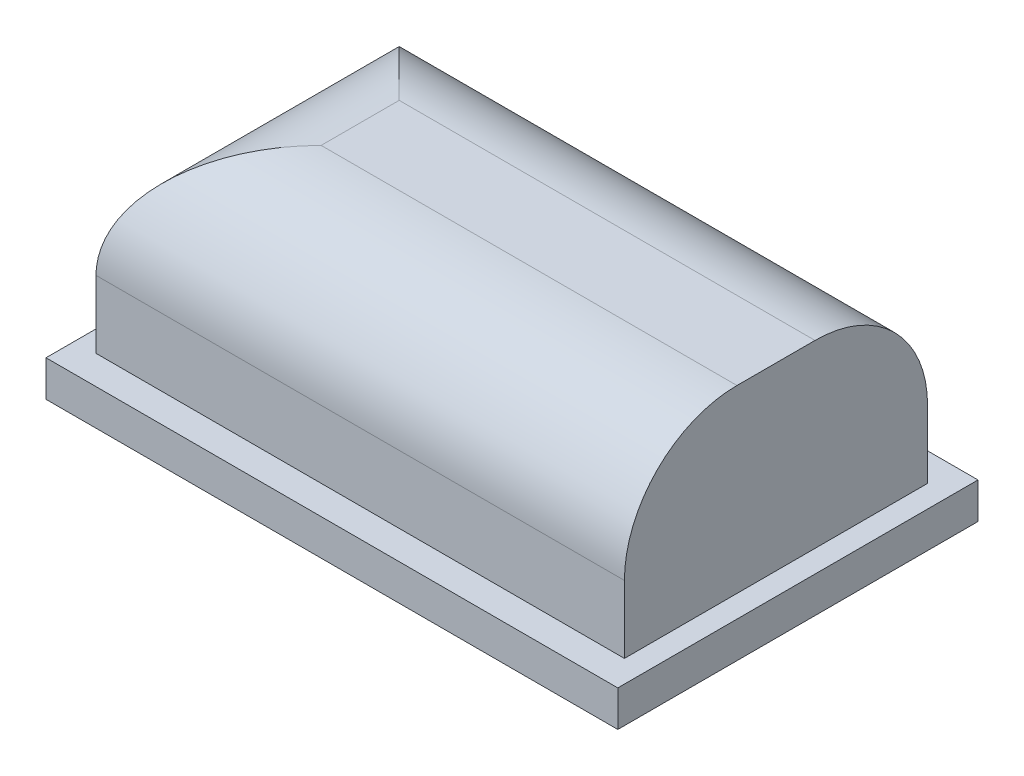
from build123d import *

# Parameters (mm, degrees)
SKETCH1_W           = 25.4
SKETCH1_H           = 16
BOSS_EXTRUDE1_DEPTH = 1.6
SKETCH2_W           = 23.471528358
SKETCH2_H           = 13.466700145
BOSS_EXTRUDE2_DEPTH = 8
FILLET1_R           = 5


with BuildPart() as part:
    # Sketch1 → Boss-Extrude1 (new body)
    with BuildSketch(Plane(origin=(0, 0, 0), x_dir=(1, 0, 0), z_dir=(0, 1, 0))):
        with Locations((12.7, 8)):
            Rectangle(SKETCH1_W, SKETCH1_H)
    extrude(amount=BOSS_EXTRUDE1_DEPTH)

    # Sketch2 → Boss-Extrude2 (add)
    with BuildSketch(Plane(origin=(0, 1.6, 0), x_dir=(1, 0, 0), z_dir=(0, 1, 0))):
        with Locations((12.677642984, 8.013617828)):
            Rectangle(SKETCH2_W, SKETCH2_H)
    extrude(amount=BOSS_EXTRUDE2_DEPTH)

    # Fillet1
    fillet1_edges = [part.edges().sort_by_distance(p)[0] for p in [
        (0.941878805, 9.6, -8.013617827),
        (12.677642984, 9.6, -1.280267755),
        (12.677642984, 9.6, -14.7469679),
    ]]
    fillet(fillet1_edges, radius=FILLET1_R)


solid = part.part
